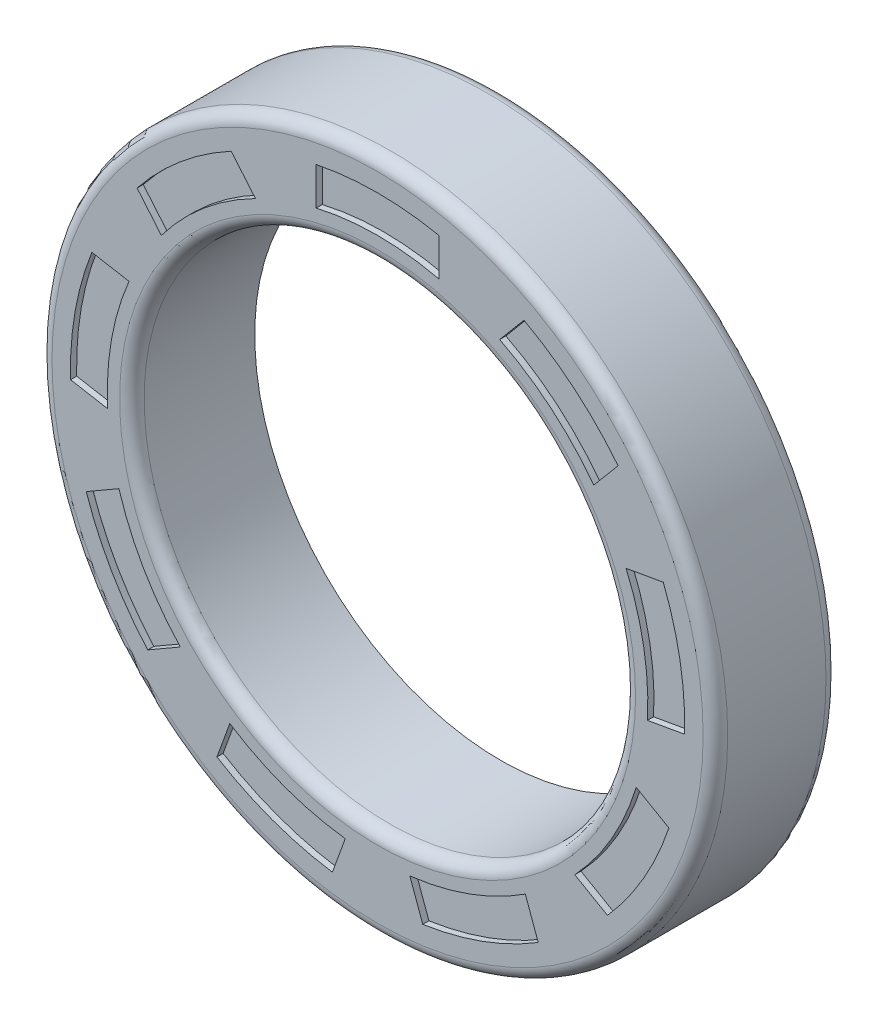
from build123d import *

# Parameters (mm, degrees)
SKETCH_1_R          = 27.5
EXTRUDE_1_DEPTH     = 10
SKETCH_2_R          = 20
CUT_EXTRUDE_1_DEPTH = 20
SKETCH_3_R          = 25.5
SKETCH_3_R_2        = 22
CUT_EXTRUDE_2_DEPTH = 7
FILLET_1_R          = 1
CUT_EXTRUDE_START   = -0.5
CUT_EXTRUDE_3_DEPTH = 0.5
FILLET_2_R          = 1


with BuildPart() as part:
    # 草图1 → 拉伸1 (new body)
    with BuildSketch(Plane.XY):
        Circle(SKETCH_1_R)
    extrude(amount=EXTRUDE_1_DEPTH)

    # 草图2 → 切除-拉伸1 (cut)
    with BuildSketch(Plane.XY.offset(10)):
        Circle(SKETCH_2_R)
    extrude(amount=-CUT_EXTRUDE_1_DEPTH, mode=Mode.SUBTRACT)

    # 草图3 → 切除-拉伸2 (cut)
    with BuildSketch(Plane(origin=(0, 0, 0), x_dir=(-1, 0, 0), z_dir=(0, 0, -1))):
        Circle(SKETCH_3_R)
        Circle(SKETCH_3_R_2, mode=Mode.SUBTRACT)
    extrude(amount=-CUT_EXTRUDE_2_DEPTH, mode=Mode.SUBTRACT)

    # 圆角1
    fillet_1_edges = [part.edges().sort_by_distance(p)[0] for p in [
        (-27.5, 0, 0),
        (-27.5, 0, 10),
    ]]
    fillet(fillet_1_edges, radius=FILLET_1_R)

    # 草图4 → 切除-拉伸3 (cut)
    with BuildSketch(Plane.XY.offset(10).offset(CUT_EXTRUDE_START)):
        with BuildLine():
            Line((17.601487344, 13.198016642), (19.575238783, 15.550242011))
            ThreePointArc((19.575238783, 15.550242011), (16.069690242, 19.151111078), (11.914794352, 21.978118108))
            Line((11.914794352, 21.978118108), (9.941042912, 19.625892739))
            ThreePointArc((9.941042912, 19.625892739), (14.141327413, 16.852977749), (17.601487344, 13.198016642))
        make_face()
        with BuildLine():
            Line((5, 21.424285286), (5, 24.494897428))
            ThreePointArc((5, 24.494897428), (0, 25), (-5, 24.494897428))
            Line((-5, 24.494897428), (-5, 21.424285286))
            ThreePointArc((-5, 21.424285286), (0, 22), (5, 21.424285286))
        make_face()
        with BuildLine():
            Line((21.96704314, -1.203750667), (24.991005785, -0.670544465))
            ThreePointArc((24.991005785, -0.670544465), (24.620193825, 4.341204442), (23.254524008, 9.177533066))
            Line((23.254524008, 9.177533066), (20.230561364, 8.644326863))
            ThreePointArc((20.230561364, 8.644326863), (21.665770566, 3.820259909), (21.96704314, -1.203750667))
        make_face()
        with BuildLine():
            Line((16.053975315, -15.042269662), (18.713203436, -16.577575733))
            ThreePointArc((18.713203436, -16.577575733), (21.650635095, -12.5), (23.713203436, -7.917321695))
            Line((23.713203436, -7.917321695), (21.053975315, -6.382015624))
            ThreePointArc((21.053975315, -6.382015624), (19.052558883, -11), (16.053975315, -15.042269662))
        make_face()
        with BuildLine():
            Line((2.62907402, -21.842343505), (3.679285225, -24.727775076))
            ThreePointArc((3.679285225, -24.727775076), (8.550503583, -23.49231552), (13.076211433, -21.307573643))
            Line((13.076211433, -21.307573643), (12.026000228, -18.422142072))
            ThreePointArc((12.026000228, -18.422142072), (7.524443153, -20.673237657), (2.62907402, -21.842343505))
        make_face()
        with BuildLine():
            Line((-12.026000228, -18.422142072), (-13.076211433, -21.307573643))
            ThreePointArc((-13.076211433, -21.307573643), (-8.550503583, -23.49231552), (-3.679285225, -24.727775076))
            Line((-3.679285225, -24.727775076), (-2.62907402, -21.842343505))
            ThreePointArc((-2.62907402, -21.842343505), (-7.524443153, -20.673237657), (-12.026000228, -18.422142072))
        make_face()
        with BuildLine():
            Line((-21.053975315, -6.382015624), (-23.713203436, -7.917321695))
            ThreePointArc((-23.713203436, -7.917321695), (-21.650635095, -12.5), (-18.713203436, -16.577575733))
            Line((-18.713203436, -16.577575733), (-16.053975315, -15.042269662))
            ThreePointArc((-16.053975315, -15.042269662), (-19.052558883, -11), (-21.053975315, -6.382015624))
        make_face()
        with BuildLine():
            Line((-20.230561364, 8.644326863), (-23.254524008, 9.177533066))
            ThreePointArc((-23.254524008, 9.177533066), (-24.620193825, 4.341204442), (-24.991005785, -0.670544465))
            Line((-24.991005785, -0.670544465), (-21.96704314, -1.203750667))
            ThreePointArc((-21.96704314, -1.203750667), (-21.665770566, 3.820259909), (-20.230561364, 8.644326863))
        make_face()
        with BuildLine():
            Line((-9.941042912, 19.625892739), (-11.914794352, 21.978118108))
            ThreePointArc((-11.914794352, 21.978118108), (-16.069690242, 19.151111078), (-19.575238783, 15.550242011))
            Line((-19.575238783, 15.550242011), (-17.601487344, 13.198016642))
            ThreePointArc((-17.601487344, 13.198016642), (-14.141327413, 16.852977749), (-9.941042912, 19.625892739))
        make_face()
    extrude(amount=CUT_EXTRUDE_3_DEPTH, mode=Mode.SUBTRACT)

    # 圆角2
    fillet_2_edges = [part.edges().sort_by_distance(p)[0] for p in [
        (-20, 0, 10),
    ]]
    fillet(fillet_2_edges, radius=FILLET_2_R)


solid = part.part
